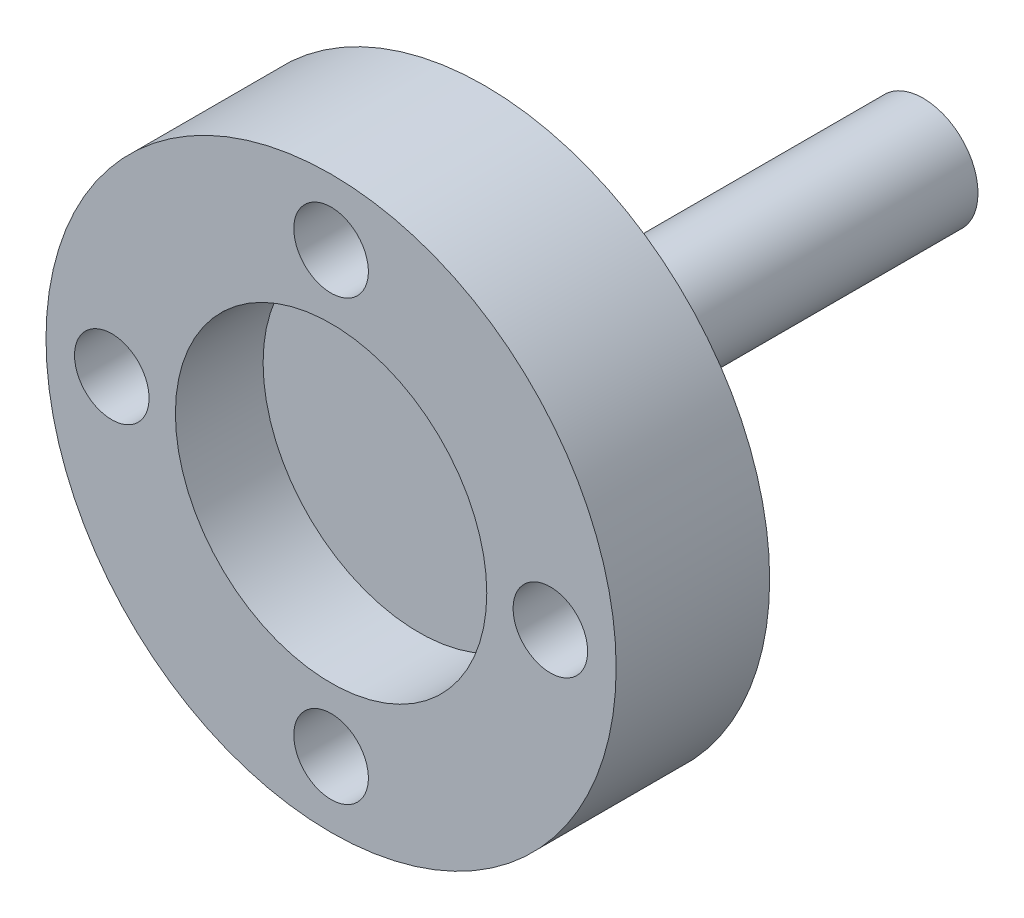
from build123d import *

# Parameters (mm, degrees)
SKETCH_1_R          = 13
EXTRUDE_1_DEPTH     = 7
SKETCH_2_R          = 7.1
CUT_EXTRUDE_1_DEPTH = 4
SKETCH_3_R          = 2.5
EXTRUDE_2_DEPTH     = 20
HOLE_WIZARD_M31_D   = 3.4


with BuildPart() as part:
    # Эскиз1 → Бобышка-Вытянуть1 (new body)
    with BuildSketch(Plane.XY):
        Circle(SKETCH_1_R)
    extrude(amount=EXTRUDE_1_DEPTH)

    # Эскиз2 → Вырез-Вытянуть1 (cut)
    with BuildSketch(Plane.XY.offset(7)):
        Circle(SKETCH_2_R)
    extrude(amount=-CUT_EXTRUDE_1_DEPTH, mode=Mode.SUBTRACT)

    # Эскиз3 → Бобышка-Вытянуть2 (add)
    with BuildSketch(Plane(origin=(0, 0, 0), x_dir=(-1, 0, 0), z_dir=(0, 0, -1))):
        with Locations(Location((0, 0, 0), (0, 0, 180))):
            Circle(SKETCH_3_R)
    extrude(amount=EXTRUDE_2_DEPTH)

    # Отверстие с зазором M31 (through all)
    with Locations(Plane(origin=(0, 0, 0), x_dir=(-1, 0, 0), z_dir=(0, 0, -1))):
        with Locations((0, 10), (-10, 0), (0, -10), (10, 0)):
            Hole(HOLE_WIZARD_M31_D / 2)


solid = part.part
